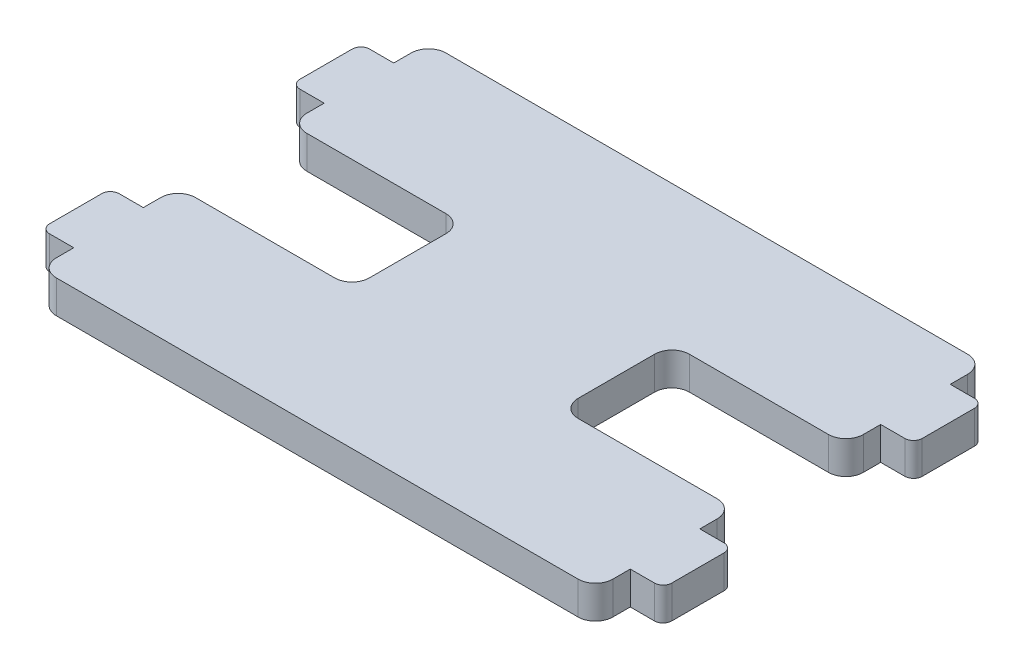
from build123d import *

# Parameters (mm, degrees)
BOSS_EXTRUDE1_DEPTH = 1.5
FILLET1_R           = 1.5875
SKETCH2_W           = 3
SKETCH2_H           = 6.35
BOSS_EXTRUDE2_DEPTH = 3
FILLET2_R           = 0.79375


with BuildPart() as part:
    # Sketch1 → Boss-Extrude1 (new, symmetric)
    with BuildSketch(Plane(origin=(0, 0, 0), x_dir=(1, 0, 0), z_dir=(0, 1, 0))):
        Polygon((25.4, 5.08), (9.525, 5.08), (9.525, -5.08), (25.4, -5.08), (25.4, -17.78), (6.592009247, -17.78), (0, -17.78), (-12.457990753, -17.78), (-25.4, -17.78), (-25.4, -5.08), (-9.525, -5.08), (-9.525, 5.08), (-25.4, 5.08), (-25.4, 17.78), (25.4, 17.78), align=None)
    extrude(amount=BOSS_EXTRUDE1_DEPTH, both=True)

    # Fillet1
    fillet1_edges = [part.edges().sort_by_distance(p)[0] for p in [
        (25.4, 0, -17.78),
        (25.4, 0, -5.08),
        (9.525, 0, -5.08),
        (9.525, 0, 5.08),
        (25.4, 0, 5.08),
        (25.4, 0, 17.78),
        (-25.4, 0, 17.78),
        (-25.4, 0, 5.08),
        (-9.525, 0, 5.08),
        (-9.525, 0, -5.08),
        (-25.4, 0, -5.08),
        (-25.4, 0, -17.78),
    ]]
    fillet(fillet1_edges, radius=FILLET1_R)

    # Sketch2 → Boss-Extrude2 (add)
    with BuildSketch(Plane(origin=(0, 1.5, 0), x_dir=(1, 0, 0), z_dir=(0, 1, 0))):
        with Locations((-26.9, 11.43)):
            Rectangle(SKETCH2_W, SKETCH2_H)
        with Locations((26.9, 11.43)):
            Rectangle(SKETCH2_W, SKETCH2_H)
        with Locations((26.9, -11.43)):
            Rectangle(SKETCH2_W, SKETCH2_H)
        with Locations((-26.9, -11.43)):
            Rectangle(SKETCH2_W, SKETCH2_H)
    extrude(amount=-BOSS_EXTRUDE2_DEPTH)

    # Fillet2
    fillet2_edges = [part.edges().sort_by_distance(p)[0] for p in [
        (-28.4, 0, 14.605),
        (-28.4, 0, 8.255),
        (28.4, 0, 8.255),
        (28.4, 0, 14.605),
        (28.4, 0, -14.605),
        (28.4, 0, -8.255),
        (-28.4, 0, -8.255),
        (-28.4, 0, -14.605),
    ]]
    fillet(fillet2_edges, radius=FILLET2_R)


solid = part.part
